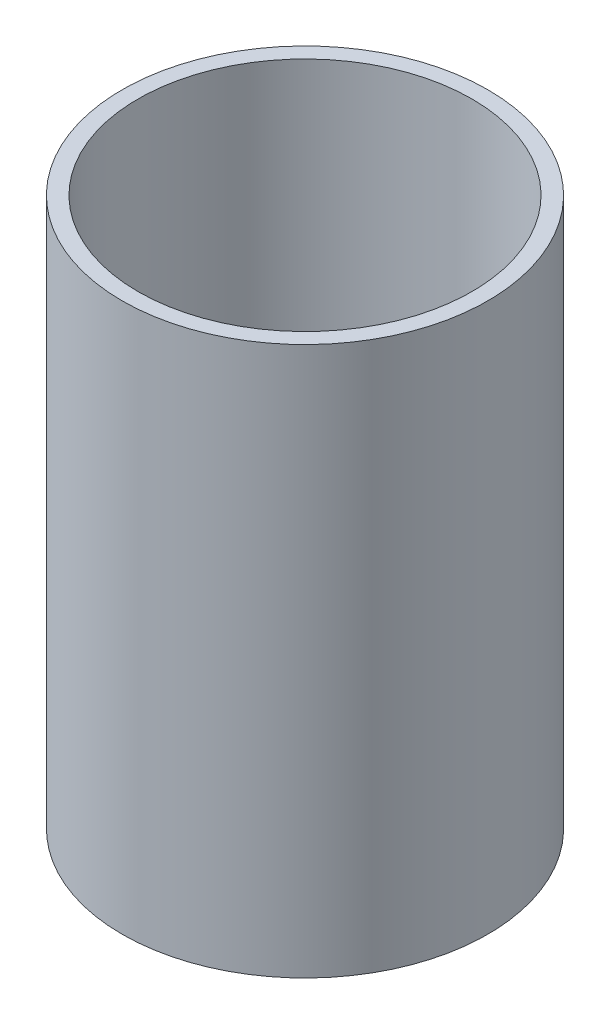
from build123d import *

# Parameters (mm, degrees)
SKETCH1_R           = 11.666
SKETCH1_R_2         = 10.65
BOSS_EXTRUDE1_DEPTH = 35


with BuildPart() as part:
    # Sketch1 → Boss-Extrude1 (new body)
    with BuildSketch(Plane(origin=(0, 0, 0), x_dir=(0.9998860245595665, 0, -0.015097612078275651), z_dir=(0, 1, 0))):
        with Locations(Location((-53.912398563, 33.159274187, 0), (0, 0, 269.134937682))):
            Circle(SKETCH1_R)
        with Locations(Location((-53.912398563, 33.159274187, 0), (0, 0, 269.134937682))):
            Circle(SKETCH1_R_2, mode=Mode.SUBTRACT)
    extrude(amount=BOSS_EXTRUDE1_DEPTH)


solid = part.part
